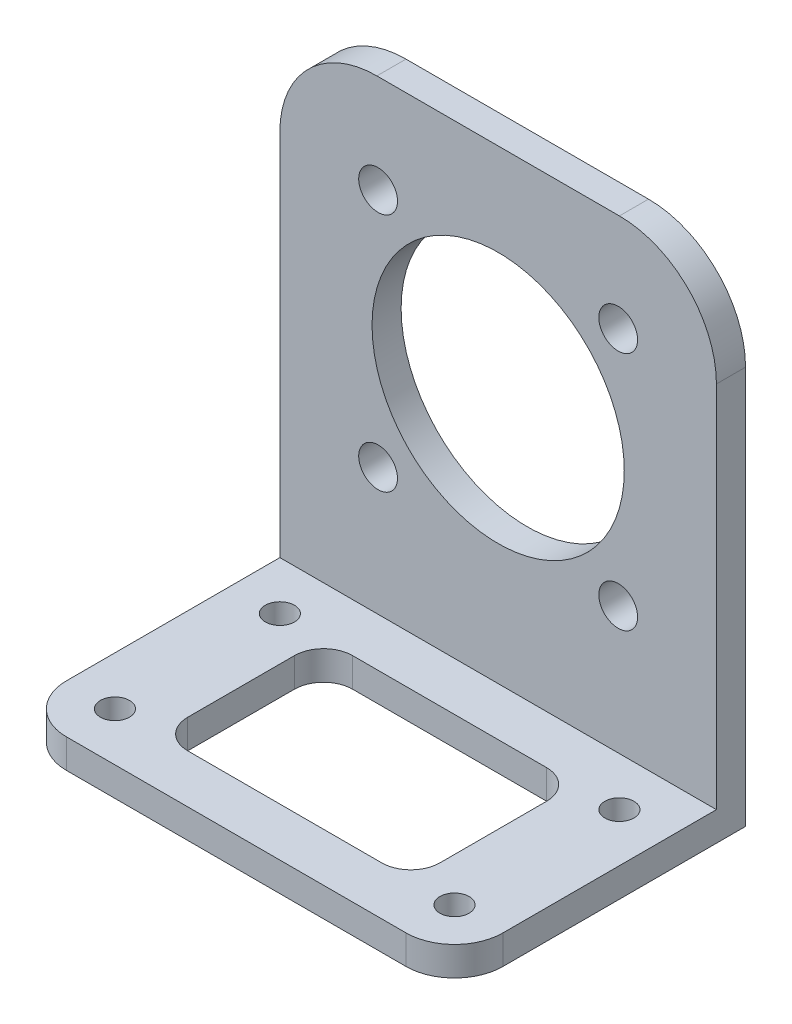
from build123d import *

# Parameters (mm, degrees)
SKETCH_1_W          = 45
SKETCH_1_H          = 51
EXTRUDE_1_DEPTH     = 30
SKETCH_2_W          = 27
SKETCH_2_H          = 48
CUT_EXTRUDE_1_DEPTH = 60.793394284
SKETCH_3_R          = 1.5
SKETCH_3_W          = 26
SKETCH_3_H          = 17
CUT_EXTRUDE_2_DEPTH = 61.911821513
FILLET_1_R          = 3
SKETCH_4_R          = 13
SKETCH_4_R_2        = 2
CUT_EXTRUDE_3_DEPTH = 30
FILLET_2_R          = 10
FILLET_3_R          = 5


with BuildPart() as part:
    # 草图1 → 凸台-拉伸1 (new body)
    with BuildSketch(Plane.XY):
        Rectangle(SKETCH_1_W, SKETCH_1_H)
    extrude(amount=EXTRUDE_1_DEPTH)

    # 草图2 → 切除-拉伸1 (cut, through all)
    with BuildSketch(Plane(origin=(22.5, 0, 0), x_dir=(0, 0, -1), z_dir=(1, 0, 0))):
        with Locations((-16.5, 1.5)):
            Rectangle(SKETCH_2_W, SKETCH_2_H)
    extrude(amount=-CUT_EXTRUDE_1_DEPTH, mode=Mode.SUBTRACT)

    # 草图3 → 切除-拉伸2 (cut, through all)
    with BuildSketch(Plane(origin=(0, -22.5, 0), x_dir=(1, 0, 0), z_dir=(0, 1, 0))):
        with Locations(Location((-17.5, -8, 0), (0, 0, 270))):
            Circle(SKETCH_3_R)
        with Locations(Location((-17.5, -25, 0), (0, 0, 270))):
            Circle(SKETCH_3_R)
        with Locations(Location((17.5, -25, 0), (0, 0, 90))):
            Circle(SKETCH_3_R)
        with Locations(Location((17.5, -8, 0), (0, 0, 90))):
            Circle(SKETCH_3_R)
        with Locations((0, -16.5)):
            Rectangle(SKETCH_3_W, SKETCH_3_H)
    extrude(amount=-CUT_EXTRUDE_2_DEPTH, mode=Mode.SUBTRACT)

    # 圆角1
    fillet_1_edges = [part.edges().sort_by_distance(p)[0] for p in [
        (13, -24, 8),
        (13, -24, 25),
        (-13, -24, 25),
        (-13, -24, 8),
    ]]
    fillet(fillet_1_edges, radius=FILLET_1_R)

    # 草图4 → 切除-拉伸3 (cut)
    with BuildSketch(Plane.XY.offset(3)):
        with Locations((0, 3)):
            Circle(SKETCH_4_R)
        with Locations((12.374368671, 15.374368671)):
            Circle(SKETCH_4_R_2)
        with Locations((-12.374368671, 15.374368671)):
            Circle(SKETCH_4_R_2)
        with Locations((-12.374368671, -9.374368671)):
            Circle(SKETCH_4_R_2)
        with Locations((12.374368671, -9.374368671)):
            Circle(SKETCH_4_R_2)
    extrude(amount=-CUT_EXTRUDE_3_DEPTH, mode=Mode.SUBTRACT)

    # 圆角2
    fillet_2_edges = [part.edges().sort_by_distance(p)[0] for p in [
        (-22.5, 25.5, 1.5),
        (22.5, 25.5, 1.5),
    ]]
    fillet(fillet_2_edges, radius=FILLET_2_R)

    # 圆角3
    fillet_3_edges = [part.edges().sort_by_distance(p)[0] for p in [
        (-22.5, -24, 30),
        (22.5, -24, 30),
    ]]
    fillet(fillet_3_edges, radius=FILLET_3_R)


solid = part.part
